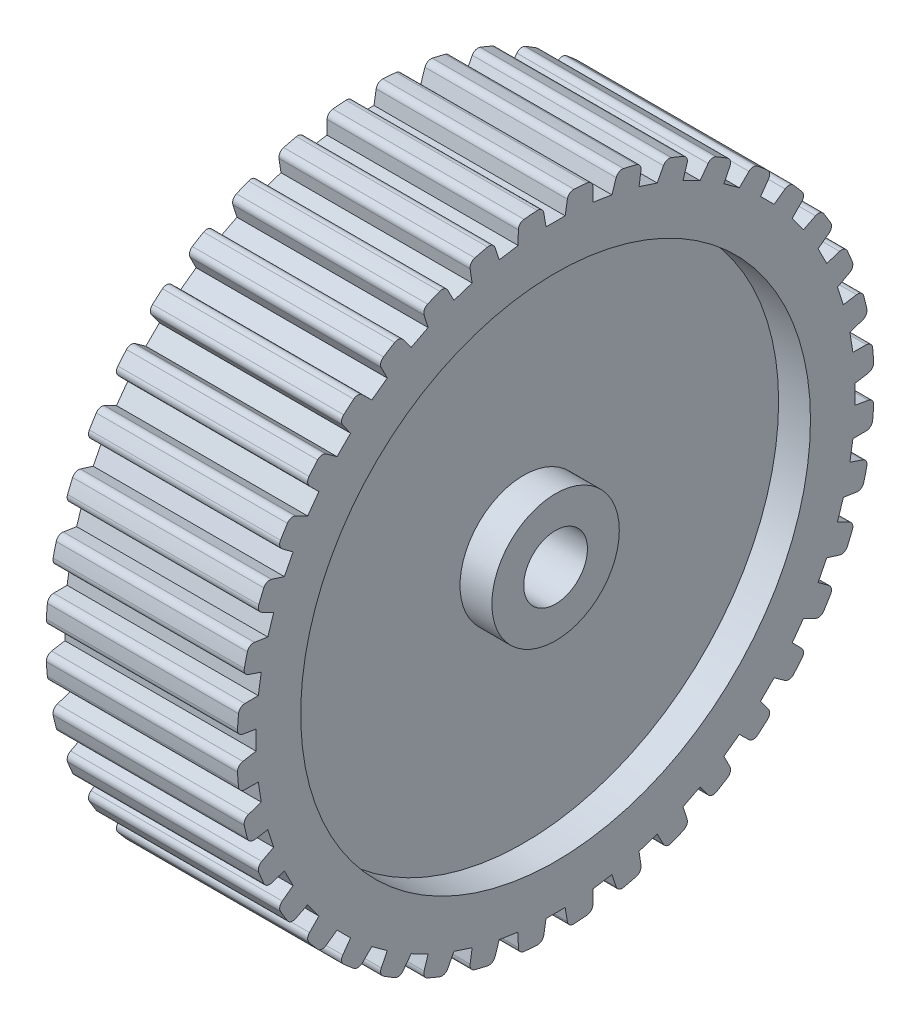
from build123d import *

# Parameters (mm, degrees)
CUT_EXTRUDE1_DEPTH       = 44
FILLET1_R                = 1
CIRPATTERN1_COUNT        = 40
FILLET1_OF_CIRPATTERN1_R = 1


with BuildPart() as part:
    # Sketch1 → Revolve1 (revolve)
    with BuildSketch(Plane.XY, mode=Mode.PRIVATE) as revolve1_sk:
        Polygon((0, 5), (-30, 5), (-30, 10), (-25, 10), (-25, 40), (-30, 40), (-30, 50), (0, 50), (0, 40), (-5, 40), (-5, 10), (0, 10), align=None)
    revolve(revolve1_sk.sketch.rotate(Axis((0, 0, 0), (-1, 0, 0)), 90), axis=Axis((0, 0, 0), (-1, 0, 0)))

    # Sketch2 → Cut-Extrude1 (cut)
    with BuildSketch(Plane(origin=(0, 0, 0), x_dir=(0, 0, -1), z_dir=(1, 0, 0))):
        Polygon((-2.5, 53), (-1.5, 47), (1.5, 47), (2.5, 53), align=None)
    cut_extrude1 = extrude(amount=-CUT_EXTRUDE1_DEPTH, mode=Mode.SUBTRACT)

    # Fillet1
    fillet1_edges = [part.edges().sort_by_distance(p)[0] for p in [
        (-15, 49.960248768, -1.993374795),
        (-15, 49.960248768, 1.993374795),
    ]]
    fillet(fillet1_edges, radius=FILLET1_R)

    # CirPattern1: Cut-Extrude1 ×40 about axis
    cirpattern1_axis = Axis((0, 0, 0), (1, 0, 0))
    for i in range(1, CIRPATTERN1_COUNT):
        add(cut_extrude1.rotate(cirpattern1_axis, i * 360 / CIRPATTERN1_COUNT), mode=Mode.SUBTRACT)

    # Fillet1 of CirPattern1
    fillet1_of_cirpattern1_edges = [part.edges().sort_by_distance(p)[0] for p in [
        (-15, 49.656987721, 5.846671746),
        (-15, 49.033322681, 9.784337832),
        (-15, 48.131006834, 13.542753825),
        (-15, 46.899033459, 17.334378),
        (-15, 45.419880821, 20.905368358),
        (-15, 43.609934383, 24.457588252),
        (-15, 41.590366603, 27.753223342),
        (-15, 39.24701399, 30.978571512),
        (-15, 36.736759528, 33.917701859),
        (-15, 33.917701859, 36.736759528),
        (-15, 30.978571512, 39.24701399),
        (-15, 27.753223342, 41.590366603),
        (-15, 24.457588252, 43.609934383),
        (-15, 20.905368358, 45.419880821),
        (-15, 17.334378, 46.899033459),
        (-15, 13.542753825, 48.131006834),
        (-15, 9.784337832, 49.033322681),
        (-15, 5.846671746, 49.656987721),
        (-15, 1.993374795, 49.960248768),
        (-15, -1.993374795, 49.960248768),
        (-15, -5.846671746, 49.656987721),
        (-15, -9.784337832, 49.033322681),
        (-15, -13.542753825, 48.131006834),
        (-15, -17.334378, 46.899033459),
        (-15, -20.905368358, 45.419880821),
        (-15, -24.457588252, 43.609934383),
        (-15, -27.753223342, 41.590366603),
        (-15, -30.978571512, 39.24701399),
        (-15, -33.917701859, 36.736759528),
        (-15, -36.736759528, 33.917701859),
        (-15, -39.24701399, 30.978571512),
        (-15, -41.590366603, 27.753223342),
        (-15, -43.609934383, 24.457588252),
        (-15, -45.419880821, 20.905368358),
        (-15, -46.899033459, 17.334378),
        (-15, -48.131006834, 13.542753825),
        (-15, -49.033322681, 9.784337832),
        (-15, -49.656987721, 5.846671746),
        (-15, -49.960248768, 1.993374795),
        (-15, -49.960248768, -1.993374795),
        (-15, -49.656987721, -5.846671746),
        (-15, -49.033322681, -9.784337832),
        (-15, -48.131006834, -13.542753825),
        (-15, -46.899033459, -17.334378),
        (-15, -45.419880821, -20.905368358),
        (-15, -43.609934383, -24.457588252),
        (-15, -41.590366603, -27.753223342),
        (-15, -39.24701399, -30.978571512),
        (-15, -36.736759528, -33.917701859),
        (-15, -33.917701859, -36.736759528),
        (-15, -30.978571512, -39.24701399),
        (-15, -27.753223342, -41.590366603),
        (-15, -24.457588252, -43.609934383),
        (-15, -20.905368358, -45.419880821),
        (-15, -17.334378, -46.899033459),
        (-15, -13.542753825, -48.131006834),
        (-15, -9.784337832, -49.033322681),
        (-15, -5.846671746, -49.656987721),
        (-15, -1.993374795, -49.960248768),
        (-15, 1.993374795, -49.960248768),
        (-15, 5.846671746, -49.656987721),
        (-15, 9.784337832, -49.033322681),
        (-15, 13.542753825, -48.131006834),
        (-15, 17.334378, -46.899033459),
        (-15, 20.905368358, -45.419880821),
        (-15, 24.457588252, -43.609934383),
        (-15, 27.753223342, -41.590366603),
        (-15, 30.978571512, -39.24701399),
        (-15, 33.917701859, -36.736759528),
        (-15, 36.736759528, -33.917701859),
        (-15, 39.24701399, -30.978571512),
        (-15, 41.590366603, -27.753223342),
        (-15, 43.609934383, -24.457588252),
        (-15, 45.419880821, -20.905368358),
        (-15, 46.899033459, -17.334378),
        (-15, 48.131006834, -13.542753825),
        (-15, 49.033322681, -9.784337832),
        (-15, 49.656987721, -5.846671746),
    ]]
    fillet(fillet1_of_cirpattern1_edges, radius=FILLET1_OF_CIRPATTERN1_R)


solid = part.part
